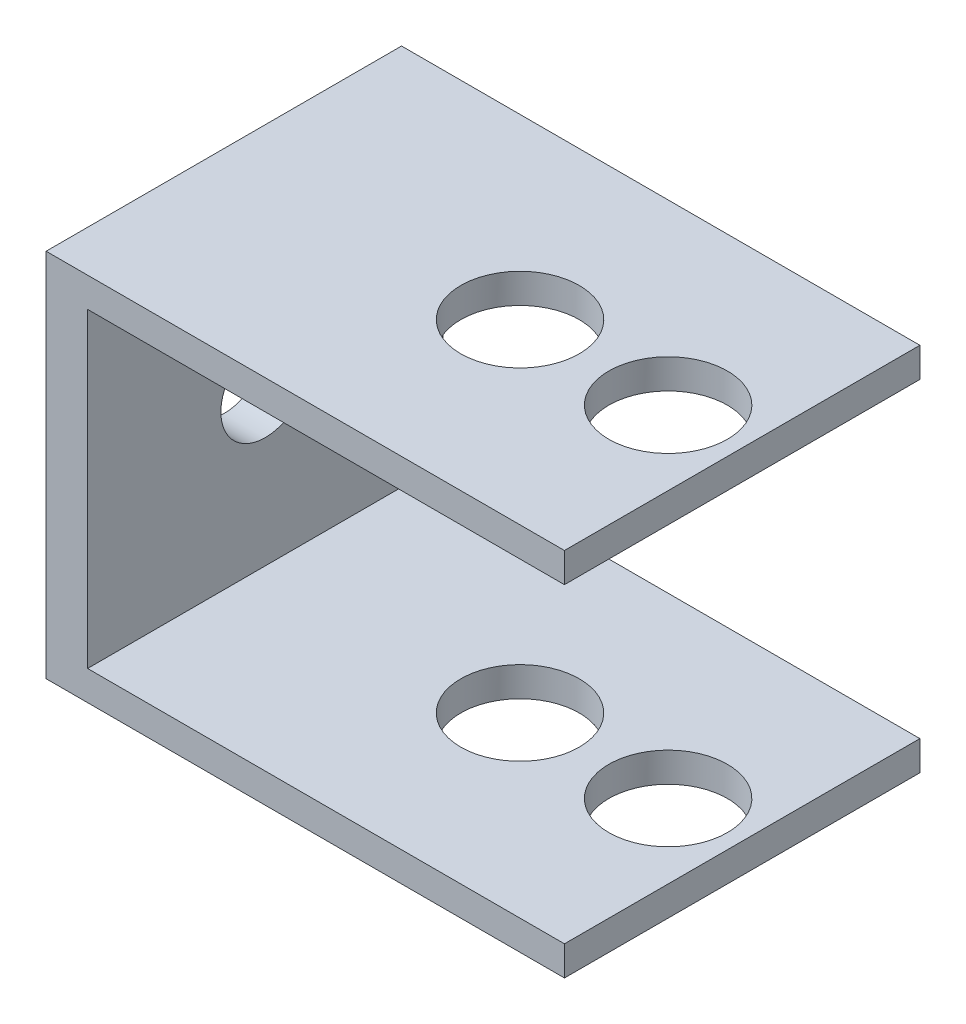
from build123d import *

# Parameters (mm, degrees)
BOSS_EXTRU_1_DEPTH      = 24
ENL_V_MAT_EXTRU_1_REACH = 40.823
ESQUISSE2_R             = 4
ENL_V_MAT_EXTRU_2_REACH = 46.241
ESQUISSE3_R             = 3


with BuildPart() as part:
    # Esquisse1 → Boss.-Extru.1 (new body)
    with BuildSketch(Plane.XY):
        Polygon((17.5, -10.5), (17.5, -12.5), (-17.5, -12.5), (-17.5, 12.5), (17.5, 12.5), (17.5, 10.5), (-14.7, 10.5), (-14.7, -10.5), align=None)
    extrude(amount=BOSS_EXTRU_1_DEPTH)

    # Enlèv. mat.-Extru.1: up to this face of the body (flat: up to its plane)
    enl_v_mat_extru_1_end = Plane(part.part.faces().sort_by_distance((0, -12.5, 12))[0])
    # Esquisse2 → Enlèv. mat.-Extru.1 (cut, up to the picked face)
    with BuildSketch(Plane(origin=(0, 12.5, 0), x_dir=(1, 0, 0), z_dir=(0, 1, 0)), mode=Mode.PRIVATE) as enl_v_mat_extru_1_sk1:
        with Locations(Location((12.5, -12, 0), (0, 0, 270))):
            Circle(ESQUISSE2_R)
    enl_v_mat_extru_1_tool1 = split(extrude(enl_v_mat_extru_1_sk1.sketch, amount=-ENL_V_MAT_EXTRU_1_REACH, mode=Mode.PRIVATE), bisect_by=enl_v_mat_extru_1_end, keep=Keep.BOTH, mode=Mode.PRIVATE)
    # Esquisse2 → Enlèv. mat.-Extru.1 (cut, up to the picked face)
    with BuildSketch(Plane(origin=(0, 12.5, 0), x_dir=(1, 0, 0), z_dir=(0, 1, 0)), mode=Mode.PRIVATE) as enl_v_mat_extru_1_sk2:
        with Locations(Location((2.5, -12, 0), (0, 0, 270))):
            Circle(ESQUISSE2_R)
    enl_v_mat_extru_1_tool2 = split(extrude(enl_v_mat_extru_1_sk2.sketch, amount=-ENL_V_MAT_EXTRU_1_REACH, mode=Mode.PRIVATE), bisect_by=enl_v_mat_extru_1_end, keep=Keep.BOTH, mode=Mode.PRIVATE)
    add(enl_v_mat_extru_1_tool1.solids().sort_by(Axis((12.5, 12.5, 12), (0, -1, 0)))[0], mode=Mode.SUBTRACT)
    add(enl_v_mat_extru_1_tool2.solids().sort_by(Axis((2.5, 12.5, 12), (0, -1, 0)))[0], mode=Mode.SUBTRACT)

    # Esquisse3 → Enlèv. mat.-Extru.2 (cut, up to next)
    with BuildSketch(Plane.ZY.offset(17.5), mode=Mode.PRIVATE) as enl_v_mat_extru_2_sk1:
        with Locations(Location((12, 0, 0), (0, 0, 270))):
            Circle(ESQUISSE3_R)
    enl_v_mat_extru_2_tool1 = extrude(enl_v_mat_extru_2_sk1.sketch, amount=-ENL_V_MAT_EXTRU_2_REACH, mode=Mode.PRIVATE) & part.part
    add(enl_v_mat_extru_2_tool1.solids().sort_by_distance((-17.5, 0, 12))[0], mode=Mode.SUBTRACT)


solid = part.part
